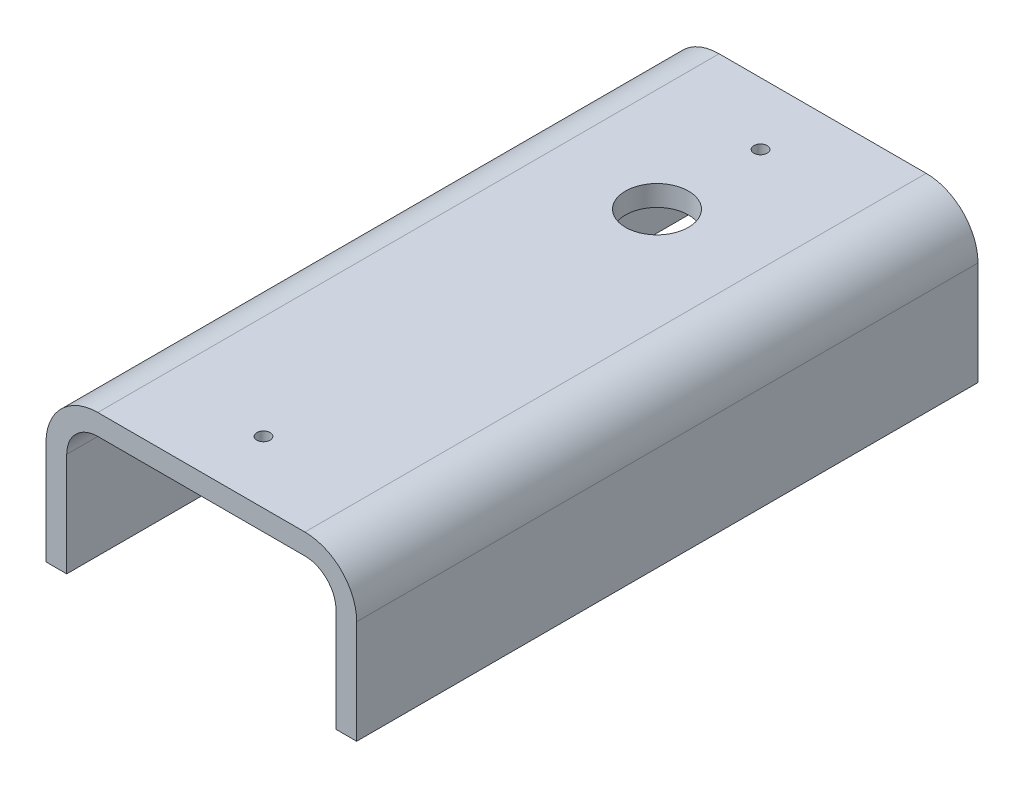
from build123d import *

# Parameters (mm, degrees)
BOSS_EXTRUDE1_DEPTH = 150
SKETCH2_R           = 1.6
CUT_EXTRUDE1_DEPTH  = 160.099025767
SKETCH4_R           = 7.6
CUT_EXTRUDE2_DEPTH  = 160.099025767


with BuildPart() as part:
    # Sketch1 → Boss-Extrude1 (new body)
    with BuildSketch(Plane(origin=(0, 0, 0), x_dir=(0, 1, 0), z_dir=(0, 0, 1))):
        with BuildLine():
            Line((-18.75, 37.5), (-18.75, 32.5))
            Line((-18.75, 32.5), (6.25, 32.5))
            ThreePointArc((6.25, 32.5), (11.553300859, 30.303300859), (13.75, 25))
            Line((13.75, 25), (13.75, -25))
            ThreePointArc((13.75, -25), (11.553300859, -30.303300859), (6.25, -32.5))
            Line((6.25, -32.5), (-18.75, -32.5))
            Line((-18.75, -32.5), (-18.75, -37.5))
            Line((-18.75, -37.5), (6.25, -37.5))
            ThreePointArc((6.25, -37.5), (15.088834765, -33.838834765), (18.75, -25))
            Line((18.75, -25), (18.75, 25))
            ThreePointArc((18.75, 25), (15.088834765, 33.838834765), (6.25, 37.5))
            Line((6.25, 37.5), (-18.75, 37.5))
        make_face()
    extrude(amount=BOSS_EXTRUDE1_DEPTH)

    # Sketch2 → Cut-Extrude1 (cut, through all)
    with BuildSketch(Plane(origin=(0, 18.75, 0), x_dir=(-1, 0, 0), z_dir=(0, 1, 0))):
        with Locations(Location((0, 135, 0), (0, 0, 90))):
            Circle(SKETCH2_R)
        with Locations(Location((0, 15, 0), (0, 0, 90))):
            Circle(SKETCH2_R)
    extrude(amount=-CUT_EXTRUDE1_DEPTH, mode=Mode.SUBTRACT)

    # Sketch4 → Cut-Extrude2 (cut, through all)
    with BuildSketch(Plane(origin=(0, 18.75, 0), x_dir=(-1, 0, 0), z_dir=(0, 1, 0))):
        with Locations(Location((0, 40, 0), (0, 0, 90))):
            Circle(SKETCH4_R)
    extrude(amount=-CUT_EXTRUDE2_DEPTH, mode=Mode.SUBTRACT)


solid = part.part
